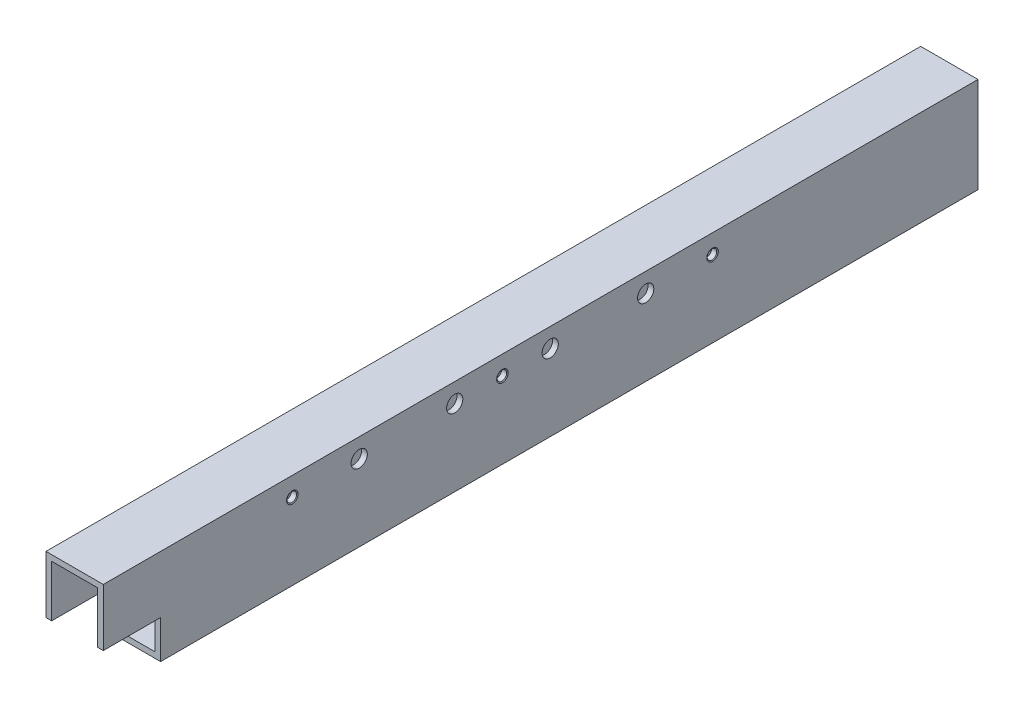
from build123d import *

# Parameters (mm, degrees)
SKETCH_1_W                   = 30
SKETCH_1_H                   = 50
SKETCH_1_W_2                 = 24
SKETCH_1_H_2                 = 44
EXTRUDE_1_DEPTH              = 458
SKETCH_2_W                   = 30
SKETCH_2_H                   = 20
CUT_EXTRUDE_1_DEPTH          = 462.696870251
HOLE_WIZARD_M61_D            = 5
HOLE_WIZARD_M61_DEPTH        = 17
HOLE_WIZARD_M61_CSINK_D      = 6.05
HOLE_WIZARD_M61_CSINK_ANGLE  = 120
HOLE_WIZARD_M61_TIP          = 1.502151548
HOLE_WIZARD_M101_D           = 8.5
HOLE_WIZARD_M101_DEPTH       = 47.5
HOLE_WIZARD_M101_CSINK_D     = 10.05
HOLE_WIZARD_M101_CSINK_ANGLE = 120
HOLE_WIZARD_M101_TIP         = 2.553657631


with BuildPart() as part:
    # Эскиз1 → Вытянуть-Тонкостенный1 (new body)
    with BuildSketch(Plane.XY):
        with Locations((15, 25)):
            Rectangle(SKETCH_1_W, SKETCH_1_H)
        with Locations((15, 25)):
            Rectangle(SKETCH_1_W_2, SKETCH_1_H_2, mode=Mode.SUBTRACT)
    extrude(amount=EXTRUDE_1_DEPTH)

    # Эскиз2 → Вырез-Вытянуть1 (cut, through all)
    with BuildSketch(Plane(origin=(30, 0, 0), x_dir=(0, 0, -1), z_dir=(1, 0, 0))):
        with Locations((-443, 10)):
            Rectangle(SKETCH_2_W, SKETCH_2_H)
    extrude(amount=-CUT_EXTRUDE_1_DEPTH, mode=Mode.SUBTRACT)

    # Отверстие обработанное метчиком M61
    with Locations(Plane(origin=(30, 0, 0), x_dir=(0, 0, -1), z_dir=(1, 0, 0))):
        with Locations((-249, 40), (-359, 40), (-139, 40)):
            CounterSinkHole(HOLE_WIZARD_M61_D / 2, HOLE_WIZARD_M61_CSINK_D / 2, depth=HOLE_WIZARD_M61_DEPTH, counter_sink_angle=HOLE_WIZARD_M61_CSINK_ANGLE)
            with Locations((0, 0, -(HOLE_WIZARD_M61_DEPTH + HOLE_WIZARD_M61_TIP / 2))):  # 118° drill point
                Cone(0, HOLE_WIZARD_M61_D / 2, HOLE_WIZARD_M61_TIP, mode=Mode.SUBTRACT)

    # Отверстие обработанное метчиком M101
    with Locations(Plane.ZY):
        with Locations((224, 40), (174, 40), (324, 40), (274, 40)):
            CounterSinkHole(HOLE_WIZARD_M101_D / 2, HOLE_WIZARD_M101_CSINK_D / 2, depth=HOLE_WIZARD_M101_DEPTH, counter_sink_angle=HOLE_WIZARD_M101_CSINK_ANGLE)
            with Locations((0, 0, -(HOLE_WIZARD_M101_DEPTH + HOLE_WIZARD_M101_TIP / 2))):  # 118° drill point
                Cone(0, HOLE_WIZARD_M101_D / 2, HOLE_WIZARD_M101_TIP, mode=Mode.SUBTRACT)


solid = part.part
